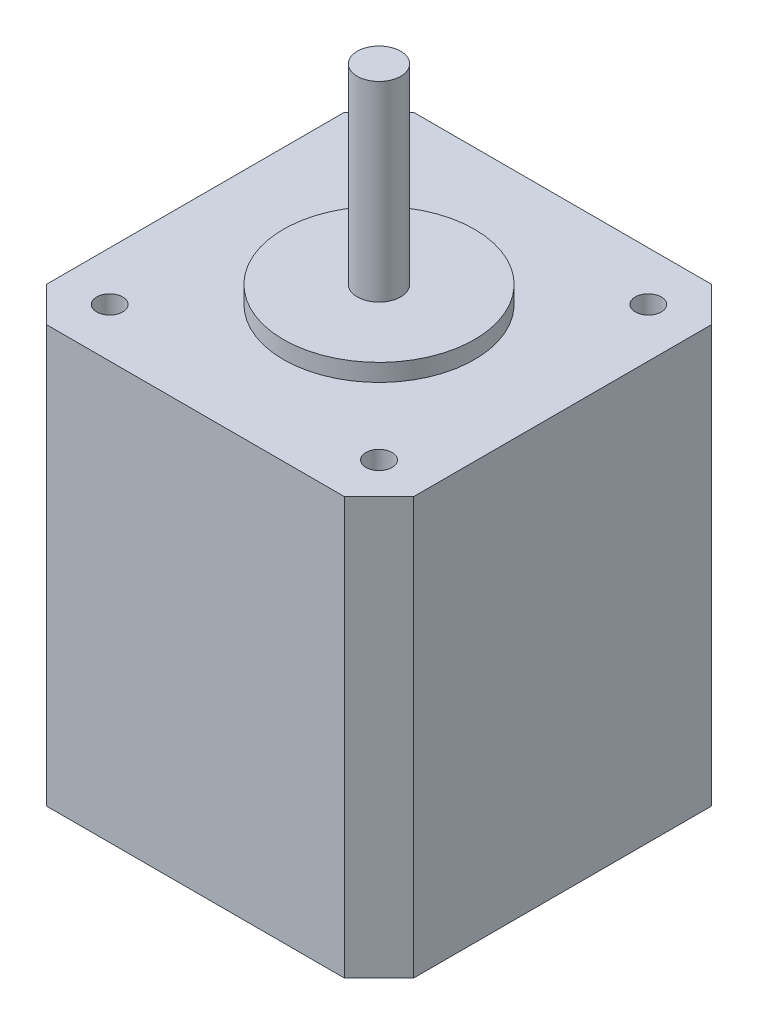
from build123d import *

# Parameters (mm, degrees)
SKETCH1_W           = 42.3
SKETCH1_H           = 42.3
BOSS_EXTRUDE1_DEPTH = 48
CUT_EXTRUDE1_DEPTH  = 57.556564606
SKETCH2_3_R         = 1.5
CUT_EXTRUDE2_DEPTH  = 4.5
SKETCH2_4_R         = 11
BOSS_EXTRUDE2_DEPTH = 2
SKETCH2_5_R         = 2.5
BOSS_EXTRUDE3_DEPTH = 24


with BuildPart() as part:
    # Sketch1 → Boss-Extrude1 (new body)
    with BuildSketch(Plane(origin=(0, 0, 0), x_dir=(1, 0, 0), z_dir=(0, 1, 0))):
        Rectangle(SKETCH1_W, SKETCH1_H)
    extrude(amount=BOSS_EXTRUDE1_DEPTH)

    # Sketch2 → Cut-Extrude1 (cut, through all)
    with BuildSketch(Plane(origin=(0, 48, 0), x_dir=(1, 0, 0), z_dir=(0, 1, 0))):
        Polygon((-21.15, 21.15), (-21.15, 17.15), (-17.15, 21.15), align=None)
        Polygon((-17.15, -21.15), (-21.15, -17.15), (-21.15, -21.15), align=None)
        Polygon((21.15, 21.15), (17.15, 21.15), (21.15, 17.15), align=None)
        Polygon((21.15, -17.15), (17.15, -21.15), (21.15, -21.15), align=None)
    extrude(amount=-CUT_EXTRUDE1_DEPTH, mode=Mode.SUBTRACT)

    # Sketch2<3> → Cut-Extrude2 (cut)
    with BuildSketch(Plane(origin=(0, 48, 0), x_dir=(1, 0, 0), z_dir=(0, 1, 0))):
        with Locations((-15.5, 15.5)):
            Circle(SKETCH2_3_R)
        with Locations((15.5, 15.5)):
            Circle(SKETCH2_3_R)
        with Locations((15.5, -15.5)):
            Circle(SKETCH2_3_R)
        with Locations((-15.5, -15.5)):
            Circle(SKETCH2_3_R)
    extrude(amount=-CUT_EXTRUDE2_DEPTH, mode=Mode.SUBTRACT)

    # Sketch2<4> → Boss-Extrude2 (add)
    with BuildSketch(Plane(origin=(0, 48, 0), x_dir=(1, 0, 0), z_dir=(0, 1, 0))):
        Circle(SKETCH2_4_R)
    extrude(amount=BOSS_EXTRUDE2_DEPTH)

    # Sketch2<5> → Boss-Extrude3 (add)
    with BuildSketch(Plane(origin=(0, 48, 0), x_dir=(1, 0, 0), z_dir=(0, 1, 0))):
        Circle(SKETCH2_5_R)
    extrude(amount=BOSS_EXTRUDE3_DEPTH)


solid = part.part
